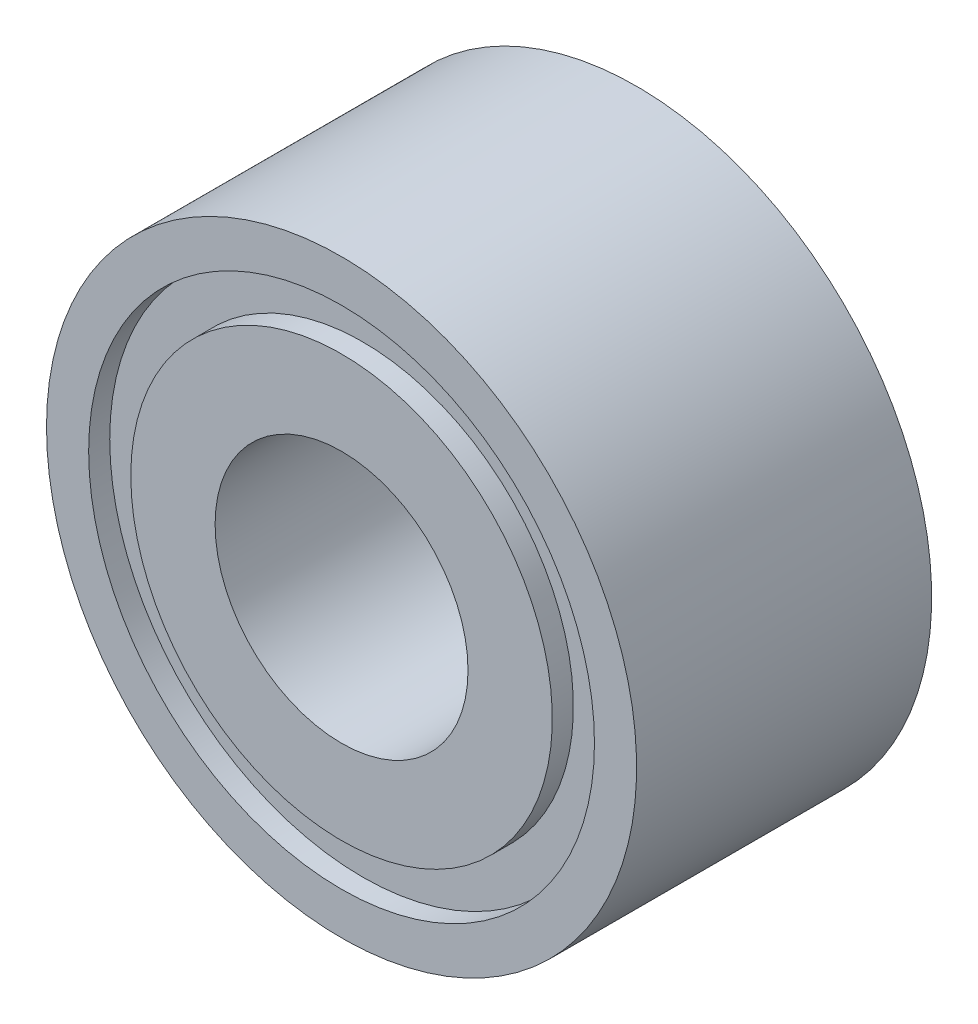
from build123d import *


with BuildPart() as part:
    # 草图1 → 旋转1 (revolve)
    with BuildSketch(Plane(origin=(0, 0, 0), x_dir=(1, 0, 0), z_dir=(0, 1, 0))):
        Polygon((-7, -3.5), (-7, 3.5), (-6, 3.5), (-6, 3), (-5, 3), (-5, 3.5), (-3, 3.5), (-3, -3.5), (-5, -3.5), (-5, -3), (-6, -3), (-6, -3.5), align=None)
    revolve(axis=Axis((0, 0, 0), (0, 0, 1)))


solid = part.part
